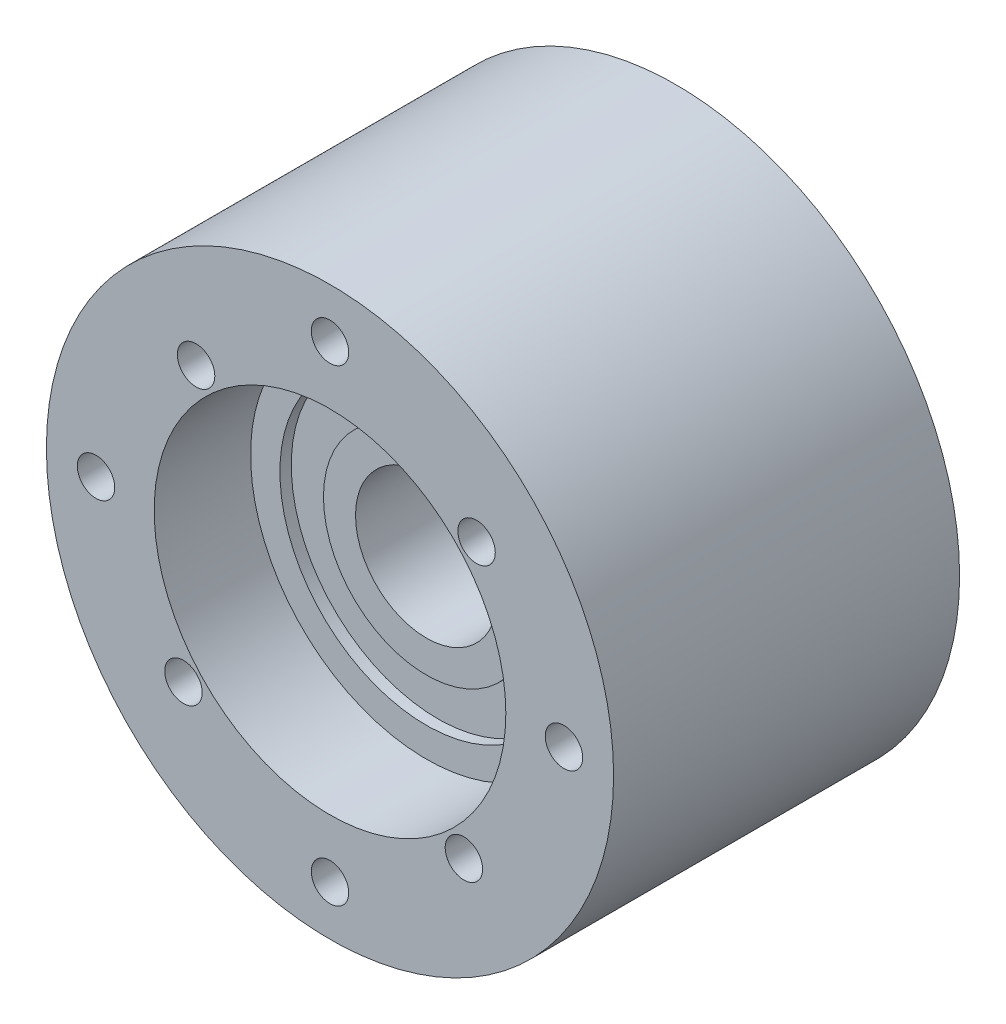
from build123d import *

# Parameters (mm, degrees)
ESQUISSE1_R                                        = 50
BOSS_EXTRU_1_DEPTH                                 = 61
ESQUISSE2_R                                        = 32.5
ENL_V_MAT_EXTRU_1_DEPTH                            = 19
ESQUISSE3_R                                        = 30
ENL_V_MAT_EXTRU_2_DEPTH                            = 7
ESQUISSE5_R                                        = 12.5
ENL_V_MAT_EXTRU_3_DEPTH                            = 79.89866919
CHAMBRAGE_POUR_VIS_T_TE_RONDE_BOMB_E_M_D           = 6.6
CHAMBRAGE_POUR_VIS_T_TE_RONDE_BOMB_E_M_CBORE_D     = 13
CHAMBRAGE_POUR_VIS_T_TE_RONDE_BOMB_E_M_CBORE_DEPTH = 4.6
ESQUISSE13_R                                       = 31
ENL_V_MAT_EXTRU_4_DEPTH                            = 17
ESQUISSE14_R                                       = 25.830239332
ESQUISSE14_R_2                                     = 18.153773443
ENL_V_MAT_EXTRU_5_DEPTH                            = 2
D_GAGEMENT_M61_D                                   = 6.6
D_GAGEMENT_M61_DEPTH                               = 5
D_GAGEMENT_M61_TIP                                 = 1.905255888


with BuildPart() as part:
    # Esquisse1 → Boss.-Extru.1 (new body)
    with BuildSketch(Plane.XY):
        with Locations(Location((0, 0, 0), (0, 0, 180))):
            Circle(ESQUISSE1_R)
    extrude(amount=BOSS_EXTRU_1_DEPTH)

    # Esquisse2 → Enlèv. mat.-Extru.1 (cut)
    with BuildSketch(Plane(origin=(0, 0, 0), x_dir=(-1, 0, 0), z_dir=(0, 0, -1))):
        Circle(ESQUISSE2_R)
    extrude(amount=-ENL_V_MAT_EXTRU_1_DEPTH, mode=Mode.SUBTRACT)

    # Esquisse3 → Enlèv. mat.-Extru.2 (cut)
    with BuildSketch(Plane(origin=(0, 0, 19), x_dir=(-1, 0, 0), z_dir=(0, 0, -1))):
        Circle(ESQUISSE3_R)
    extrude(amount=-ENL_V_MAT_EXTRU_2_DEPTH, mode=Mode.SUBTRACT)

    # Esquisse5 → Enlèv. mat.-Extru.3 (cut, through all)
    with BuildSketch(Plane(origin=(0, 0, 26), x_dir=(-1, 0, 0), z_dir=(0, 0, -1))):
        Circle(ESQUISSE5_R)
    extrude(amount=-ENL_V_MAT_EXTRU_3_DEPTH, mode=Mode.SUBTRACT)

    # Chambrage pour vis à tête ronde bombée M61 (through all)
    with Locations(Plane(origin=(0, 0, 0), x_dir=(-1, 0, 0), z_dir=(0, 0, -1))):
        with Locations((41.25, 0), (0, 41.25), (-41.25, 0), (0, -41.25)):
            CounterBoreHole(CHAMBRAGE_POUR_VIS_T_TE_RONDE_BOMB_E_M_D / 2, CHAMBRAGE_POUR_VIS_T_TE_RONDE_BOMB_E_M_CBORE_D / 2, CHAMBRAGE_POUR_VIS_T_TE_RONDE_BOMB_E_M_CBORE_DEPTH)

    # Esquisse13 → Enlèv. mat.-Extru.4 (cut)
    with BuildSketch(Plane.XY.offset(61)):
        Circle(ESQUISSE13_R)
    extrude(amount=-ENL_V_MAT_EXTRU_4_DEPTH, mode=Mode.SUBTRACT)

    # Esquisse14 → Enlèv. mat.-Extru.5 (cut)
    with BuildSketch(Plane.XY.offset(44)):
        Circle(ESQUISSE14_R)
        Circle(ESQUISSE14_R_2, mode=Mode.SUBTRACT)
    extrude(amount=-ENL_V_MAT_EXTRU_5_DEPTH, mode=Mode.SUBTRACT)

    # Dégagement M61
    with Locations(Plane.XY.offset(61)):
        with Locations((-23.608593004, 25.838621023), (-25.838621023, -23.608593004), (23.608593004, -25.838621023), (25.838621023, 23.608593004)):
            Hole(D_GAGEMENT_M61_D / 2, depth=D_GAGEMENT_M61_DEPTH)
            with Locations((0, 0, -(D_GAGEMENT_M61_DEPTH + D_GAGEMENT_M61_TIP / 2))):  # 120° drill point
                Cone(0, D_GAGEMENT_M61_D / 2, D_GAGEMENT_M61_TIP, mode=Mode.SUBTRACT)


solid = part.part
